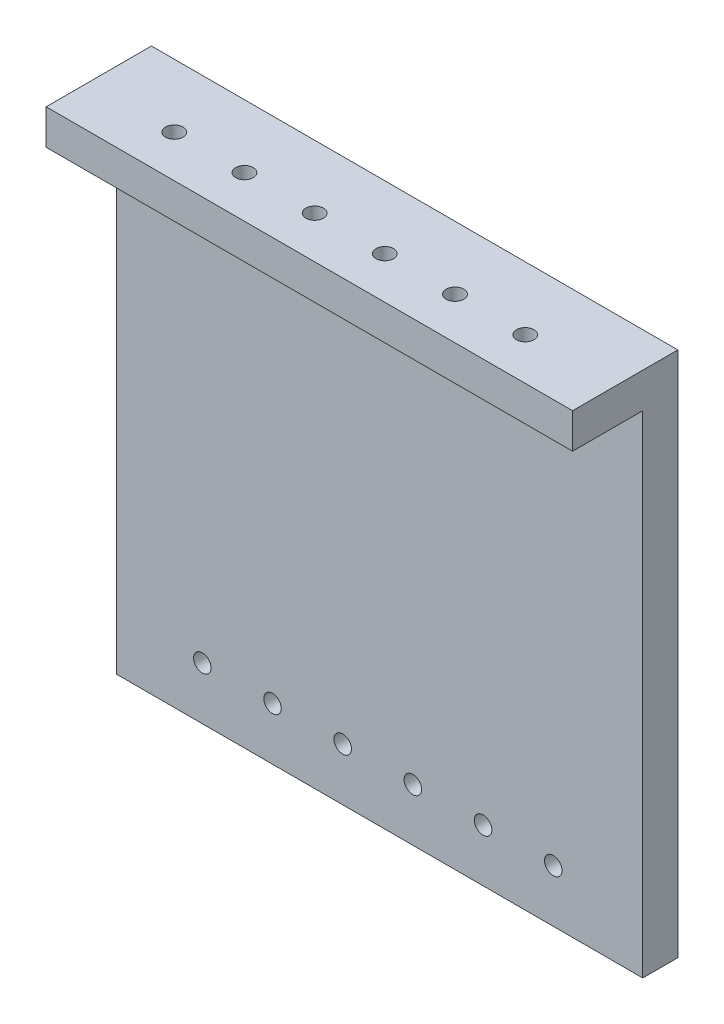
from build123d import *

# Parameters (mm, degrees)
SKETCH1_W           = 75
SKETCH1_H           = 75
SKETCH1_R           = 1.25
BOSS_EXTRUDE1_DEPTH = 5
SKETCH2_W           = 75
SKETCH2_H           = 5
BOSS_EXTRUDE2_DEPTH = 10
CUT_EXTRUDE1_REACH  = 87.184
SKETCH3_R           = 1.25


with BuildPart() as part:
    # Sketch1 → Boss-Extrude1 (new body)
    with BuildSketch(Plane.XY):
        Rectangle(SKETCH1_W, SKETCH1_H)
        with Locations((-25.25, -30)):
            Circle(SKETCH1_R, mode=Mode.SUBTRACT)
        with Locations((-15.25, -30)):
            Circle(SKETCH1_R, mode=Mode.SUBTRACT)
        with Locations((-5.25, -30)):
            Circle(SKETCH1_R, mode=Mode.SUBTRACT)
        with Locations((4.75, -30)):
            Circle(SKETCH1_R, mode=Mode.SUBTRACT)
        with Locations((14.75, -30)):
            Circle(SKETCH1_R, mode=Mode.SUBTRACT)
        with Locations((24.75, -30)):
            Circle(SKETCH1_R, mode=Mode.SUBTRACT)
    extrude(amount=BOSS_EXTRUDE1_DEPTH)

    # Sketch2 → Boss-Extrude2 (add)
    with BuildSketch(Plane.XY.offset(5)):
        with Locations((0, 35)):
            Rectangle(SKETCH2_W, SKETCH2_H)
    extrude(amount=BOSS_EXTRUDE2_DEPTH)

    # Sketch3 → Cut-Extrude1 (cut, up to next)
    with BuildSketch(Plane(origin=(0, 37.5, 0), x_dir=(1, 0, 0), z_dir=(0, 1, 0)), mode=Mode.PRIVATE) as cut_extrude1_sk1:
        with Locations(Location((-25.25, -9, 0), (0, 0, 270))):
            Circle(SKETCH3_R)
    cut_extrude1_tool1 = extrude(cut_extrude1_sk1.sketch, amount=-CUT_EXTRUDE1_REACH, mode=Mode.PRIVATE) & part.part
    # Sketch3 → Cut-Extrude1 (cut, up to next)
    with BuildSketch(Plane(origin=(0, 37.5, 0), x_dir=(1, 0, 0), z_dir=(0, 1, 0)), mode=Mode.PRIVATE) as cut_extrude1_sk2:
        with Locations(Location((-15.25, -9, 0), (0, 0, 270))):
            Circle(SKETCH3_R)
    cut_extrude1_tool2 = extrude(cut_extrude1_sk2.sketch, amount=-CUT_EXTRUDE1_REACH, mode=Mode.PRIVATE) & part.part
    # Sketch3 → Cut-Extrude1 (cut, up to next)
    with BuildSketch(Plane(origin=(0, 37.5, 0), x_dir=(1, 0, 0), z_dir=(0, 1, 0)), mode=Mode.PRIVATE) as cut_extrude1_sk3:
        with Locations(Location((-5.25, -9, 0), (0, 0, 270))):
            Circle(SKETCH3_R)
    cut_extrude1_tool3 = extrude(cut_extrude1_sk3.sketch, amount=-CUT_EXTRUDE1_REACH, mode=Mode.PRIVATE) & part.part
    # Sketch3 → Cut-Extrude1 (cut, up to next)
    with BuildSketch(Plane(origin=(0, 37.5, 0), x_dir=(1, 0, 0), z_dir=(0, 1, 0)), mode=Mode.PRIVATE) as cut_extrude1_sk4:
        with Locations(Location((4.75, -9, 0), (0, 0, 270))):
            Circle(SKETCH3_R)
    cut_extrude1_tool4 = extrude(cut_extrude1_sk4.sketch, amount=-CUT_EXTRUDE1_REACH, mode=Mode.PRIVATE) & part.part
    # Sketch3 → Cut-Extrude1 (cut, up to next)
    with BuildSketch(Plane(origin=(0, 37.5, 0), x_dir=(1, 0, 0), z_dir=(0, 1, 0)), mode=Mode.PRIVATE) as cut_extrude1_sk5:
        with Locations(Location((14.75, -9, 0), (0, 0, 270))):
            Circle(SKETCH3_R)
    cut_extrude1_tool5 = extrude(cut_extrude1_sk5.sketch, amount=-CUT_EXTRUDE1_REACH, mode=Mode.PRIVATE) & part.part
    # Sketch3 → Cut-Extrude1 (cut, up to next)
    with BuildSketch(Plane(origin=(0, 37.5, 0), x_dir=(1, 0, 0), z_dir=(0, 1, 0)), mode=Mode.PRIVATE) as cut_extrude1_sk6:
        with Locations(Location((24.75, -9, 0), (0, 0, 270))):
            Circle(SKETCH3_R)
    cut_extrude1_tool6 = extrude(cut_extrude1_sk6.sketch, amount=-CUT_EXTRUDE1_REACH, mode=Mode.PRIVATE) & part.part
    add(cut_extrude1_tool1.solids().sort_by_distance((-25.25, 37.5, 9))[0], mode=Mode.SUBTRACT)
    add(cut_extrude1_tool2.solids().sort_by_distance((-15.25, 37.5, 9))[0], mode=Mode.SUBTRACT)
    add(cut_extrude1_tool3.solids().sort_by_distance((-5.25, 37.5, 9))[0], mode=Mode.SUBTRACT)
    add(cut_extrude1_tool4.solids().sort_by_distance((4.75, 37.5, 9))[0], mode=Mode.SUBTRACT)
    add(cut_extrude1_tool5.solids().sort_by_distance((14.75, 37.5, 9))[0], mode=Mode.SUBTRACT)
    add(cut_extrude1_tool6.solids().sort_by_distance((24.75, 37.5, 9))[0], mode=Mode.SUBTRACT)


solid = part.part
